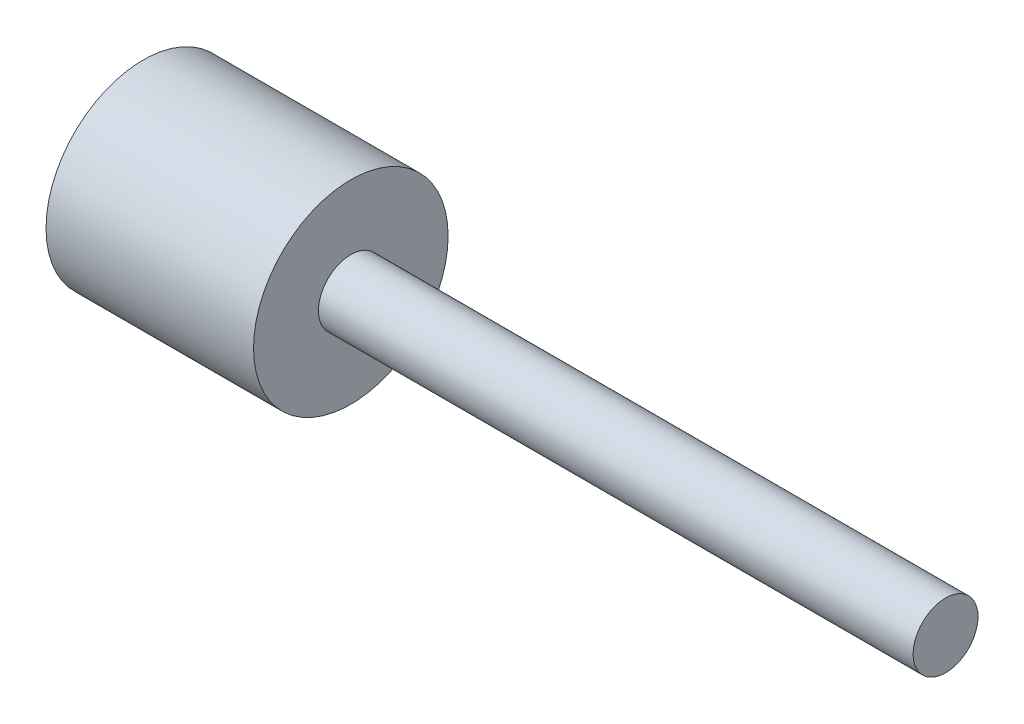
from build123d import *

# Parameters (mm, degrees)
SKETCH1_R               = 7.5
BOSS_EXTRUDE1_DEPTH     = 16
SKETCH2_R               = 2.5
BOSS_EXTRUDE2_DEPTH     = 45.85
CUT_EXTRUDE1_DEPTH      = 12
CUT_EXTRUDE2_REACH      = 65.1
CUT_EXTRUDE2_END_RADIUS = 7.5
SKETCH4_R               = 1.5


with BuildPart() as part:
    # Sketch1 → Boss-Extrude1 (new body)
    with BuildSketch(Plane(origin=(0, 0, 0), x_dir=(0, 0, -1), z_dir=(1, 0, 0))):
        Circle(SKETCH1_R)
    extrude(amount=BOSS_EXTRUDE1_DEPTH)

    # Sketch2 → Boss-Extrude2 (add)
    with BuildSketch(Plane(origin=(16, 0, 0), x_dir=(0, 0, -1), z_dir=(1, 0, 0))):
        Circle(SKETCH2_R)
    extrude(amount=BOSS_EXTRUDE2_DEPTH)

    # Sketch3 → Cut-Extrude1 (cut)
    with BuildSketch(Plane.ZY):
        with BuildLine():
            Line((-2.449489743, -2.5), (2.449489743, -2.5))
            ThreePointArc((2.449489743, -2.5), (0, 3.5), (-2.449489743, -2.5))
        make_face()
    extrude(amount=-CUT_EXTRUDE1_DEPTH, mode=Mode.SUBTRACT)

    # Cut-Extrude2: up to this cylinder (the profile starts inside it)
    cut_extrude2_end = Plane(origin=(5, 0, 0), z_dir=(-1, 0, 0)) * Cylinder(CUT_EXTRUDE2_END_RADIUS, 146.2, mode=Mode.PRIVATE)
    # Sketch4 → Cut-Extrude2 (cut, up to the surface)
    with BuildSketch(Plane(origin=(0, -2.5, 0), x_dir=(1, 0, 0), z_dir=(0, 1, 0)), mode=Mode.PRIVATE) as cut_extrude2_sk1:
        with Locations(Location((5, 0, 0), (0, 0, 270))):
            Circle(SKETCH4_R)
    cut_extrude2_tool1 = extrude(cut_extrude2_sk1.sketch, amount=-CUT_EXTRUDE2_REACH, mode=Mode.PRIVATE) & cut_extrude2_end
    add(cut_extrude2_tool1.solids().sort_by_distance((5, -2.5, 0))[0], mode=Mode.SUBTRACT)


solid = part.part
